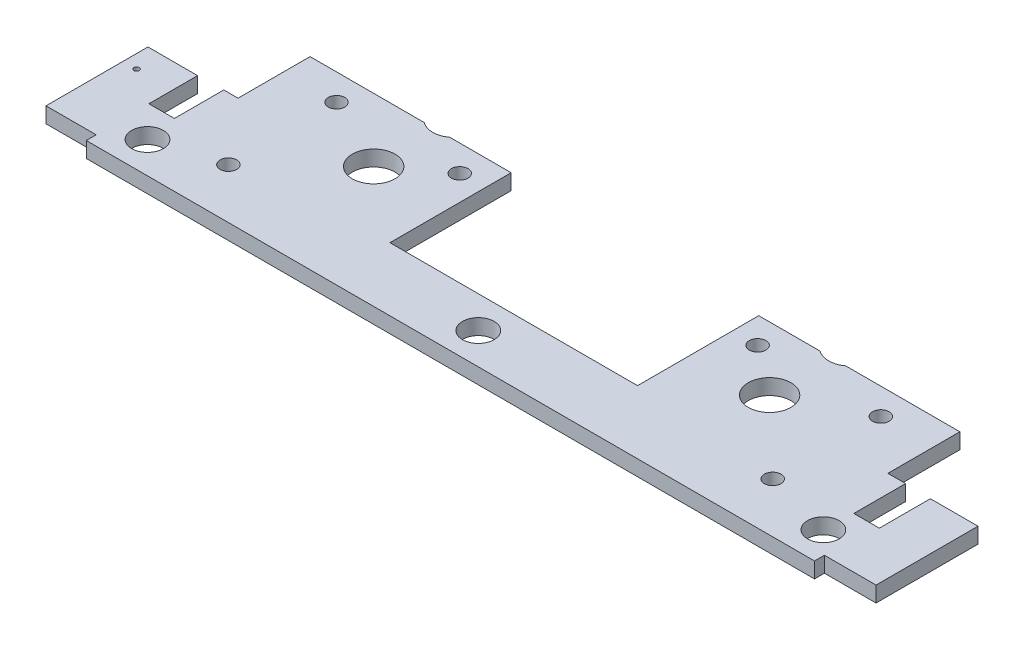
from build123d import *

# Parameters (mm, degrees)
SKETCH1_R                           = 2.159
BOSS_EXTRUDE1_DEPTH                 = 1.575
SKETCH2_W                           = 93.457658642
SKETCH2_H                           = 6.602
CUT_EXTRUDE1_DEPTH                  = 65.362755899
CUT_EXTRUDE2_DEPTH                  = 60.755092082
CUT_EXTRUDE3_DEPTH                  = 60.755092082
SKETCH6_R                           = 0.8382
CUT_EXTRUDE4_DEPTH                  = 2.54
SKETCH7_W                           = 65.648
SKETCH7_H                           = 12
CUT_EXTRUDE5_DEPTH                  = 59.286069146
SKETCH11_R                          = 0.270027719
ID_HOLE_DEPTH                       = 59.286069146
SKETCH12_W                          = 2.575
SKETCH12_H                          = 5
NOTCH_FOR_BPR_TOP_VIEW_DEPTH        = 59.286069146
SKETCH14_W                          = 2.575
SKETCH14_H                          = 12.502619879
NOTCH_FOR_BPL_TOP_VIEW_DEPTH        = 59.286069146
SKETCH17_W                          = 73.57
SKETCH17_H                          = 1
CREATE_LIP_FOR_M3_SPACER_HOLE_DEPTH = 1.575
SKETCH15_R                          = 1.6
HOLE_FOR_M3_SPACER_DEPTH            = 59.977069112
SKETCH19_W                          = 6.013982762
SKETCH19_H                          = 1.7
SKETCH19_W_2                        = 9.814467677
CUT_EXTRUDE7_DEPTH                  = 59.977069112


with BuildPart() as part:
    # Sketch1 → Boss-Extrude1 (new body)
    with BuildSketch(Plane(origin=(0, 0, 0), x_dir=(1, 0, 0), z_dir=(0, 1, 0))):
        Polygon((44.351293299, -40.014412246), (37.136293299, -40.014412246), (37.136293299, -46.615946892), (29.968293307, -46.615946892), (-30.083706693, -46.615946892), (-36.433706701, -46.615946892), (-36.433706701, -40.014412246), (-43.648706701, -40.014412246), (-43.648706701, -30.885946892), (-43.648706701, -29.647946892), (-42.378706693, -29.615946892), (-32.472706701, -29.647946892), (-32.472706701, -10.370428445), (-12.155556701, -10.370428445), (-12.155556701, -34.615947016), (-11.557706701, -34.615947016), (12.260293299, -34.615947016), (12.858143299, -34.615947016), (12.858143299, -10.370428445), (33.175293299, -10.370428445), (33.175293299, -12.929386892), (33.175293299, -29.647946892), (38.746293307, -29.615946892), (42.351293307, -29.615946892), (44.351293299, -29.615946892), (44.351293299, -31.651946892), align=None)
        with Locations(Location((-19.648556701, -28.76738335, 0), (0, 0, 270))):
            Circle(SKETCH1_R, mode=Mode.SUBTRACT)
        with Locations(Location((-19.648556701, -20.63938335, 0), (0, 0, 270))):
            Circle(SKETCH1_R, mode=Mode.SUBTRACT)
        with Locations(Location((20.351397299, -20.63938335, 0), (0, 0, 270))):
            Circle(SKETCH1_R, mode=Mode.SUBTRACT)
        with Locations(Location((20.351397299, -28.76738335, 0), (0, 0, 270))):
            Circle(SKETCH1_R, mode=Mode.SUBTRACT)
    extrude(amount=BOSS_EXTRUDE1_DEPTH)

    # Sketch2 → Cut-Extrude1 (cut, through all)
    with BuildSketch(Plane.XZ):
        with Locations((-2.377536022, 43.315412246)):
            Rectangle(SKETCH2_W, SKETCH2_H)
    extrude(amount=-CUT_EXTRUDE1_DEPTH, mode=Mode.SUBTRACT)

    # Sketch3 → Cut-Extrude2 (cut, through all)
    with BuildSketch(Plane.XZ):
        Polygon((-41.504650493, 40.014412246), (-41.504650493, 29.618770413), (-34.629650483, 29.640979175), (-34.629650483, 8.976090323), (-48.128778183, 8.976090323), (-48.128778183, 40.014412246), align=None)
    extrude(amount=-CUT_EXTRUDE2_DEPTH, mode=Mode.SUBTRACT)

    # Sketch4 → Cut-Extrude3 (cut, through all)
    with BuildSketch(Plane.XZ):
        Polygon((42.351293299, 40.014412246), (42.351293299, 32.420104455), (42.351293299, 29.615946892), (35.476293307, 29.615946892), (35.476293307, 10.370428445), (54.710892309, 10.370428445), (54.710892309, 40.014412246), align=None)
    extrude(amount=-CUT_EXTRUDE3_DEPTH, mode=Mode.SUBTRACT)

    # Sketch6 → Cut-Extrude4 (cut)
    with BuildSketch(Plane(origin=(0, 0, 0), x_dir=(-1, 0, 0), z_dir=(0, -1, 0))):
        with Locations(Location((27.141556701, -35.947946892, 0), (0, 0, 90))):
            Circle(SKETCH6_R)
        with Locations(Location((27.141556701, -25.025946892, 0), (0, 0, 90))):
            Circle(SKETCH6_R)
        with Locations(Location((14.695556701, -25.025946892, 0), (0, 0, 90))):
            Circle(SKETCH6_R)
        with Locations(Location((-15.398143299, -25.025946892, 0), (0, 0, 90))):
            Circle(SKETCH6_R)
        with Locations(Location((-27.844397299, -25.025946892, 0), (0, 0, 90))):
            Circle(SKETCH6_R)
        with Locations(Location((-27.844397299, -35.947946892, 0), (0, 0, 90))):
            Circle(SKETCH6_R)
    extrude(amount=-CUT_EXTRUDE4_DEPTH, mode=Mode.SUBTRACT)

    # Sketch7 → Cut-Extrude5 (cut, through all)
    with BuildSketch(Plane.XZ):
        with Locations((0.351293299, 16.370428445)):
            Rectangle(SKETCH7_W, SKETCH7_H)
    extrude(amount=-CUT_EXTRUDE5_DEPTH, mode=Mode.SUBTRACT)

    # Sketch11 → ID HOLE (cut, through all)
    with BuildSketch(Plane(origin=(0, 1.575, 0), x_dir=(1, 0, 0), z_dir=(0, 1, 0))):
        with Locations(Location((-40.144429695, -32.22382703, 0), (0, 0, 270))):
            Circle(SKETCH11_R)
    extrude(amount=-ID_HOLE_DEPTH, mode=Mode.SUBTRACT)

    # Sketch12 → Notch for BPR (TOP VIEW) (cut, through all)
    with BuildSketch(Plane(origin=(0, 0, 0), x_dir=(-1, 0, 0), z_dir=(0, -1, 0))):
        with Locations((35.201150493, -32.134973926)):
            Rectangle(SKETCH12_W, SKETCH12_H)
    extrude(amount=-NOTCH_FOR_BPR_TOP_VIEW_DEPTH, mode=Mode.SUBTRACT)

    # Sketch14 → Notch for BPL (TOP VIEW) (cut, through all)
    with BuildSketch(Plane(origin=(0, 0, 0), x_dir=(-1, 0, 0), z_dir=(0, -1, 0))):
        with Locations((-36.253849507, -28.621738385)):
            Rectangle(SKETCH14_W, SKETCH14_H)
    extrude(amount=-NOTCH_FOR_BPL_TOP_VIEW_DEPTH, mode=Mode.SUBTRACT)

    # Sketch17 → Create Lip for M3 Spacer Hole (add)
    with BuildSketch(Plane.XZ):
        with Locations((0.351293299, 40.514412246)):
            Rectangle(SKETCH17_W, SKETCH17_H)
    extrude(amount=-CREATE_LIP_FOR_M3_SPACER_HOLE_DEPTH)

    # Sketch15 → HOLE for M3 Spacer (cut, through all)
    with BuildSketch(Plane.XZ):
        with Locations(Location((-0.006565304, 37.835831124, 0), (0, 0, 270))):
            Circle(SKETCH15_R)
        with Locations(Location((-33.429715371, 37.835831124, 0), (0, 0, 270))):
            Circle(SKETCH15_R)
        with Locations(Location((34.851293299, 37.835831124, 0), (0, 0, 270))):
            Circle(SKETCH15_R)
    extrude(amount=-HOLE_FOR_M3_SPACER_DEPTH, mode=Mode.SUBTRACT)

    # Sketch19 → Cut-Extrude7 (cut, through all)
    with BuildSketch(Plane.XZ):
        with Locations((40.047258401, 28.864412246)):
            Rectangle(SKETCH19_W, SKETCH19_H)
        with Locations((-40.560325306, 28.864412246)):
            Rectangle(SKETCH19_W_2, SKETCH19_H)
    extrude(amount=-CUT_EXTRUDE7_DEPTH, mode=Mode.SUBTRACT)


solid = part.part
